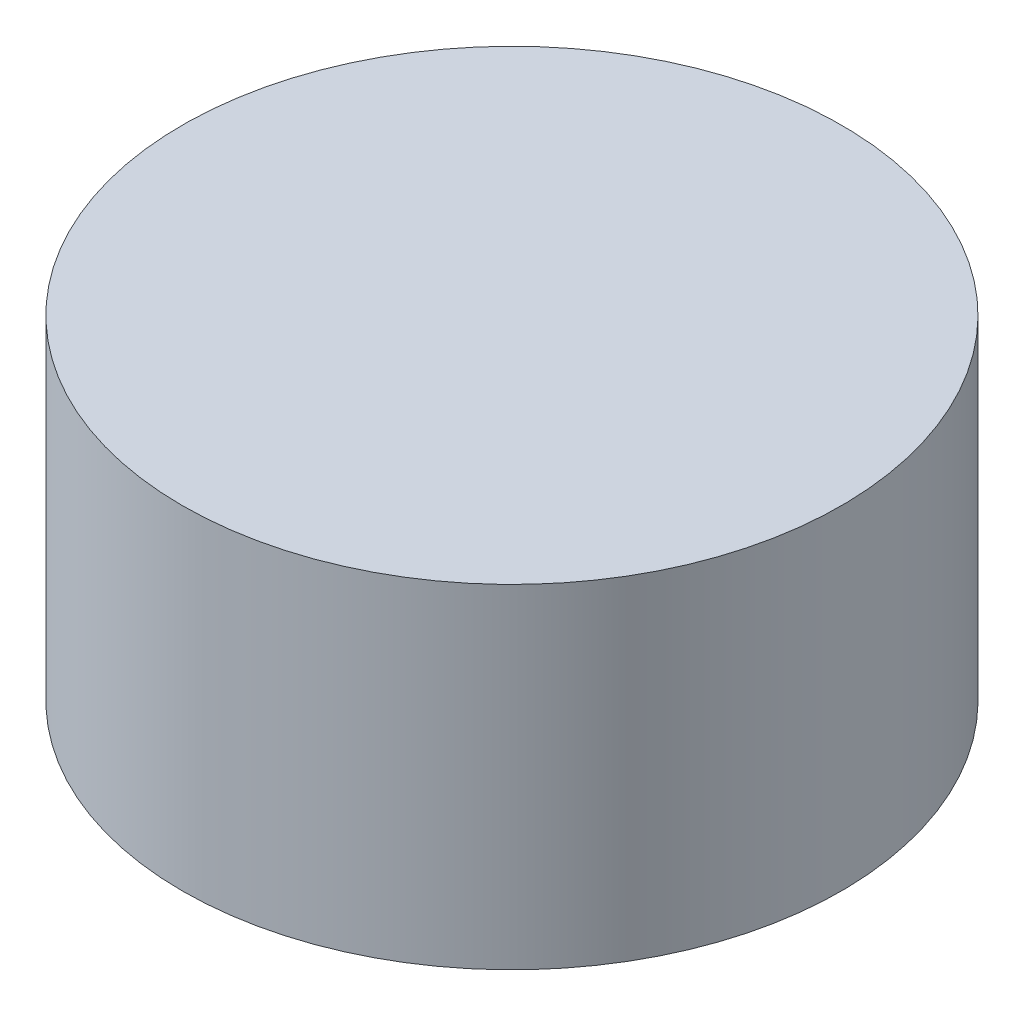
from build123d import *

# Parameters (mm, degrees)
SKETCH1_R           = 3.95
BOSS_EXTRUDE1_DEPTH = 4


with BuildPart() as part:
    # Sketch1 → Boss-Extrude1 (new body)
    with BuildSketch(Plane(origin=(0, 0, 0), x_dir=(1, 0, 0), z_dir=(0, 1, 0))):
        with Locations(Location((0, 0, 0), (0, 0, 270))):
            Circle(SKETCH1_R)
    extrude(amount=BOSS_EXTRUDE1_DEPTH)


solid = part.part
